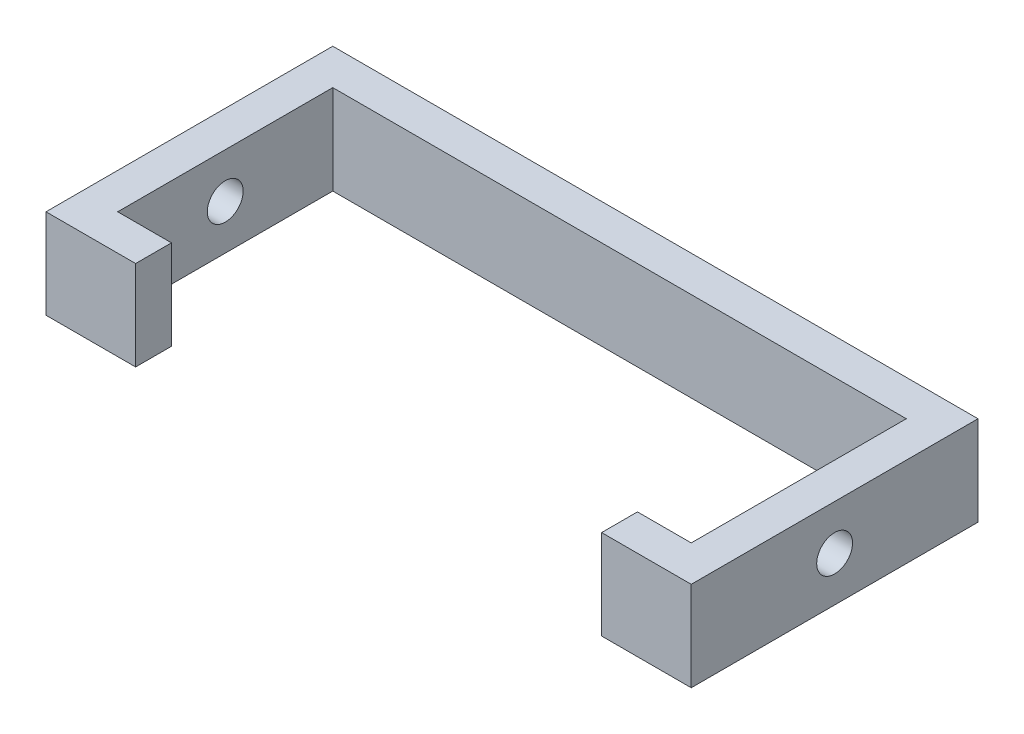
from build123d import *

# Parameters (mm, degrees)
BOSS_EXTRUDE1_DEPTH     = 2.5
CUT_EXTRUDE1_DEPTH      = 37.962819157
CUT_EXTRUDE1_DEPTH_BACK = 37.962819157
SKETCH2_R               = 1


with BuildPart() as part:
    # Sketch1 → Boss-Extrude1 (new, symmetric)
    with BuildSketch(Plane(origin=(0, 0, 0), x_dir=(1, 0, 0), z_dir=(0, 1, 0))):
        Polygon((13, -6), (13, -8), (18, -8), (18, 8), (-18, 8), (-18, -8), (-13, -8), (-13, -6), (-16, -6), (-16, 6), (16, 6), (16, -6), align=None)
    extrude(amount=BOSS_EXTRUDE1_DEPTH, both=True)

    # Sketch2 → Cut-Extrude1 (cut, two sides: drawn at the far end of the back side and taken through both)
    with BuildSketch(Plane(origin=(18, 0, 0), x_dir=(0, 0, -1), z_dir=(1, 0, 0)).offset(-CUT_EXTRUDE1_DEPTH_BACK)):
        Circle(SKETCH2_R)
    extrude(amount=CUT_EXTRUDE1_DEPTH + CUT_EXTRUDE1_DEPTH_BACK, mode=Mode.SUBTRACT)


solid = part.part
